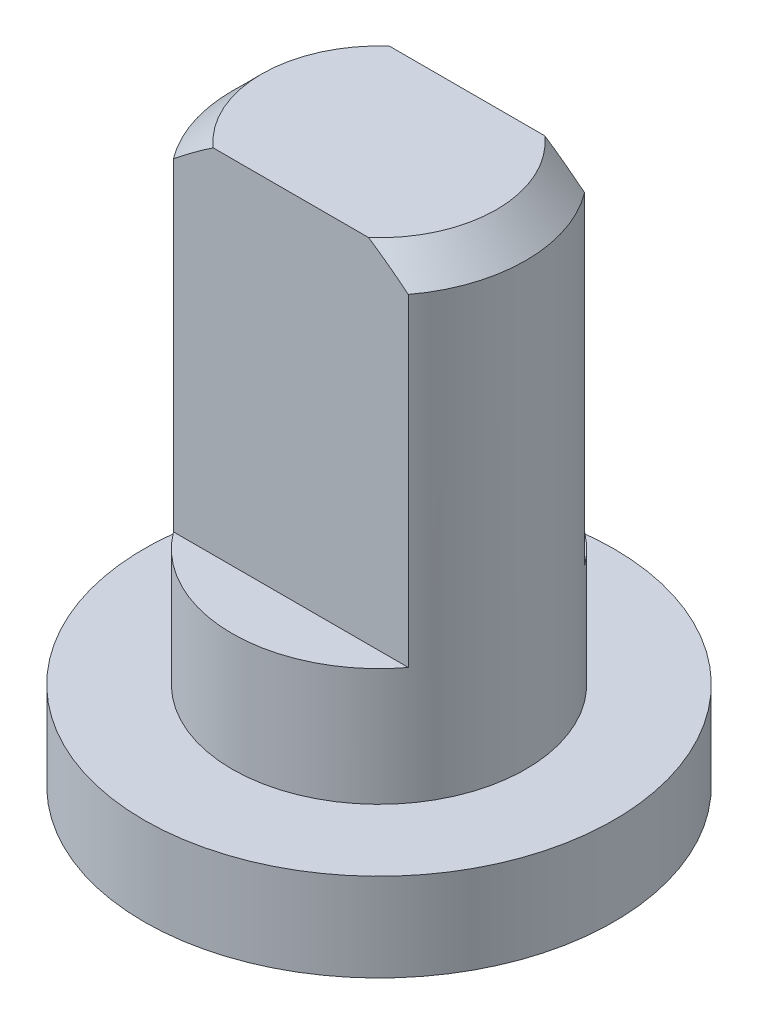
from build123d import *
from build123d.topology import SkipClean

# Parameters (mm, degrees)
SKETCH_1_R      = 4
EXTRUDE_1_DEPTH = 1.5
SKETCH_3_R      = 2.5
EXTRUDE_3_DEPTH = 2
EXTRUDE_2_DEPTH = 6
CHAMFER_1_SIZE  = 0.5


with BuildPart() as part:
    # 草图1 → 凸台-拉伸1 (new body)
    with BuildSketch(Plane(origin=(0, 0, 0), x_dir=(1, 0, 0), z_dir=(0, 1, 0))):
        with Locations(Location((0, 0, 0), (0, 0, 270))):
            Circle(SKETCH_1_R)
    extrude(amount=EXTRUDE_1_DEPTH)

    # 草图3 → 凸台-拉伸3 (add)
    with BuildSketch(Plane(origin=(0, 1.5, 0), x_dir=(1, 0, 0), z_dir=(0, 1, 0))):
        with Locations(Location((0, 0, 0), (0, 0, 270))):
            Circle(SKETCH_3_R)
    extrude(amount=EXTRUDE_3_DEPTH)

    # 草图2 → 凸台-拉伸2 (add)
    with SkipClean():  # the faces are left unmerged after this step: merging them gives an invalid solid
        with BuildSketch(Plane(origin=(0, 3.5, 0), x_dir=(1, 0, 0), z_dir=(0, 1, 0))):
            with BuildLine():
                Line((-2, 1.5), (2, 1.5))
                ThreePointArc((2, 1.5), (2.5, 0), (2, -1.5))
                Line((2, -1.5), (-2, -1.5))
                ThreePointArc((-2, -1.5), (-2.5, 0), (-2, 1.5))
            make_face()
        extrude(amount=EXTRUDE_2_DEPTH)

    # 倒角1
    chamfer_1_edges = [part.edges().sort_by_distance(p)[0] for p in [
        (-2.5, 9.5, 0),
        (2.5, 9.5, 0),
    ]]
    chamfer(chamfer_1_edges, length=CHAMFER_1_SIZE)


solid = part.part
